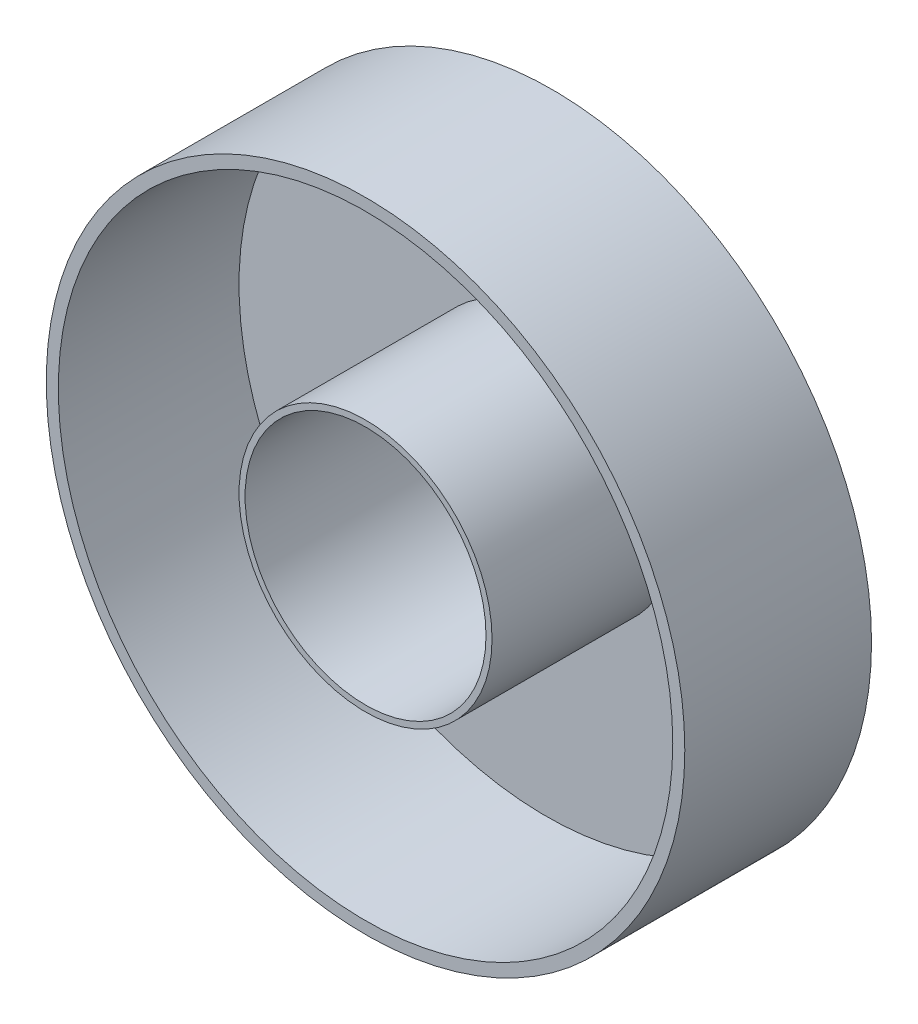
from build123d import *

# Parameters (mm, degrees)
SKETCH1_R           = 26.5
SKETCH1_R_2         = 10.5
BOSS_EXTRUDE2_DEPTH = 0.5
SKETCH2_R           = 26.5
SKETCH2_R_2         = 25.5
SKETCH2_R_3         = 10.5
SKETCH2_R_4         = 10
BOSS_EXTRUDE3_DEPTH = 15


with BuildPart() as part:
    # Sketch1 → Boss-Extrude2 (new body)
    with BuildSketch(Plane.XY):
        Circle(SKETCH1_R)
        Circle(SKETCH1_R_2, mode=Mode.SUBTRACT)
    extrude(amount=BOSS_EXTRUDE2_DEPTH)

    # Sketch2 → Boss-Extrude3 (add)
    # profile 1 of 2: a face of its own
    with BuildSketch(Plane.XY.offset(0.5)):
        Circle(SKETCH2_R)
        Circle(SKETCH2_R_2, mode=Mode.SUBTRACT)
    # profile 2 of 2: a face of its own
    with BuildSketch(Plane.XY.offset(0.5)):
        Circle(SKETCH2_R_3)
        Circle(SKETCH2_R_4, mode=Mode.SUBTRACT)
    extrude(amount=BOSS_EXTRUDE3_DEPTH)


with BuildPart() as boss_extrude3_piece_1:
    # of the separate pieces the step leaves, piece 1, a body of its own (boss_extrude3_pieces)
    add(part.part.solids().sort_by_distance((26.5, 0, 0))[0])


with BuildPart() as boss_extrude3_piece_2:
    # of the separate pieces the step leaves, piece 2, a body of its own (boss_extrude3_pieces)
    add(part.part.solids().sort_by_distance((10.5, 0, 15.5))[0])


solid = Compound([boss_extrude3_piece_1.part, boss_extrude3_piece_2.part])
